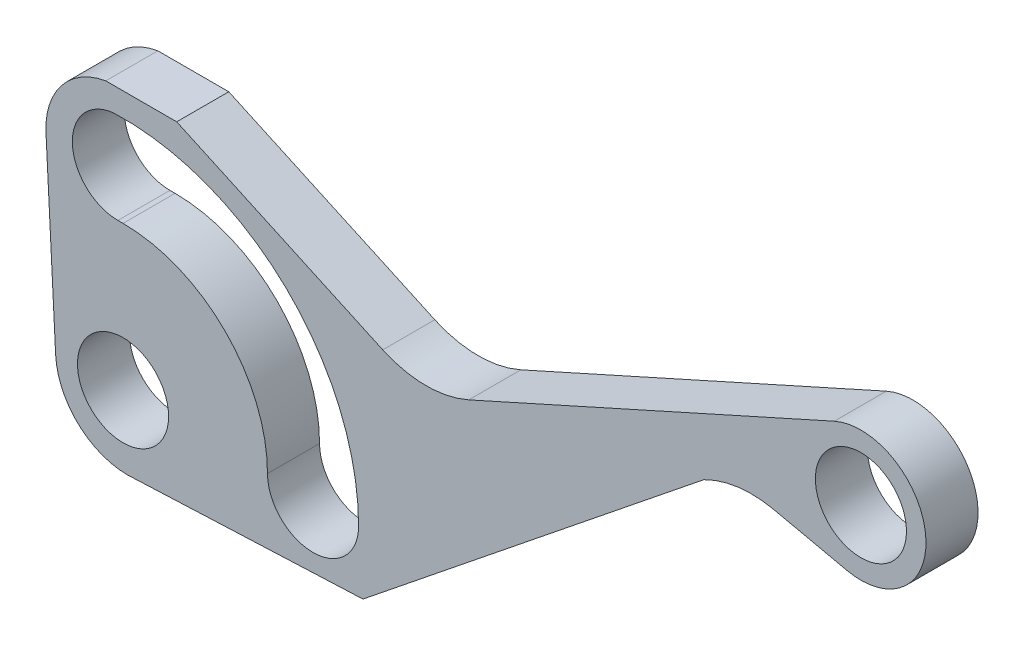
from build123d import *

# Parameters (mm, degrees)
SKETCH2_R           = 1.75
BOSS_EXTRUDE1_DEPTH = 2
SCALE1_SCALE        = 2


with BuildPart() as part:
    # Sketch2 → Boss-Extrude1 (new body)
    with BuildSketch(Plane.XY):
        with BuildLine():
            Line((-2.959686812, 7.094235734), (-2.589510897, -0.112410482))
            ThreePointArc((-2.589510897, -0.112410482), (-1.732883601, -1.97439389), (0.17059178, -2.73437679))
            Line((0.17059178, -2.73437679), (9.218440829, -2.341769901))
            Line((9.218440829, -2.341769901), (22.318004544, 8.181471599))
            ThreePointArc((22.318004544, 8.181471599), (23.631672458, 8.589402593), (25.00585725, 8.528187863))
            Line((25.00585725, 8.528187863), (27.810968992, 7.908802431))
            ThreePointArc((27.810968992, 7.908802431), (30.836871293, 10.605873355), (27.325176398, 12.630293092))
            Line((27.325176398, 12.630293092), (13.285071523, 6.320301234))
            ThreePointArc((13.285071523, 6.320301234), (11.630616958, 5.968797328), (9.978797309, 6.332482295))
            Line((9.978797309, 6.332482295), (2.062383287, 9.960674362))
            Line((2.062383287, 9.960674362), (-0.662699736, 9.960674362))
            ThreePointArc((-0.662699736, 9.960674362), (-2.356294969, 8.964265917), (-2.959686812, 7.094235734))
        make_face()
        Circle(SKETCH2_R, mode=Mode.SUBTRACT)
        with Locations((28.35, 10.35)):
            Circle(SKETCH2_R, mode=Mode.SUBTRACT)
        with BuildLine():
            Line((-0.197115754, 5.55), (0, 5.55))
            ThreePointArc((0, 5.55), (3.924442636, 3.924442636), (5.55, 0))
            ThreePointArc((5.55, 0), (7.317827511, -1.749909192), (9.049636777, 0.035653171))
            ThreePointArc((9.049636777, 0.035653171), (6.258630387, 6.536569638), (-0.357350166, 9.042648827))
            ThreePointArc((-0.357350166, 9.042648827), (-1.945276995, 7.219798525), (-0.197115754, 5.55))
        make_face(mode=Mode.SUBTRACT)
    extrude(amount=BOSS_EXTRUDE1_DEPTH)


with BuildPart() as part_1:
    # Scale1: scaled about (10.278907769, 4.487421788, 1)
    add(part.part.scale(SCALE1_SCALE).moved(Location((-10.278907769, -4.487421788, -1))))


solid = part_1.part
